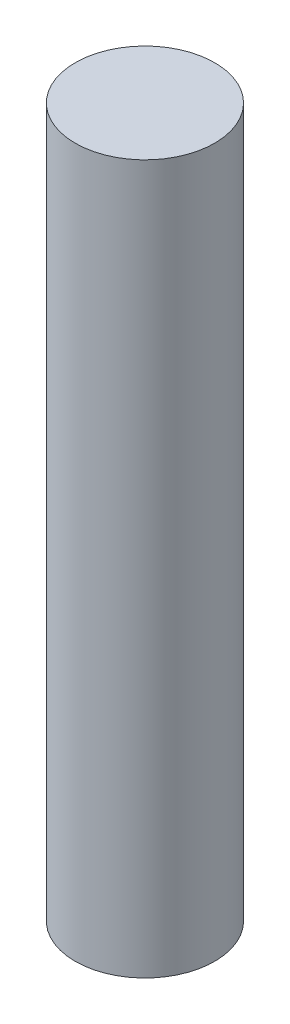
from build123d import *

# Parameters (mm, degrees)
BOSS_EXTRUDE1_START = -65.278
SKETCH1_R           = 3
BOSS_EXTRUDE1_DEPTH = 30.48


with BuildPart() as part:
    # Sketch1 → Boss-Extrude1 (new body)
    with BuildSketch(Plane(origin=(0, 0, 0), x_dir=(1, 0, 0), z_dir=(0, 1, 0)).offset(BOSS_EXTRUDE1_START)):
        with Locations(Location((0, 0, 0), (0, 0, 270))):
            Circle(SKETCH1_R)
    extrude(amount=-BOSS_EXTRUDE1_DEPTH)


solid = part.part
